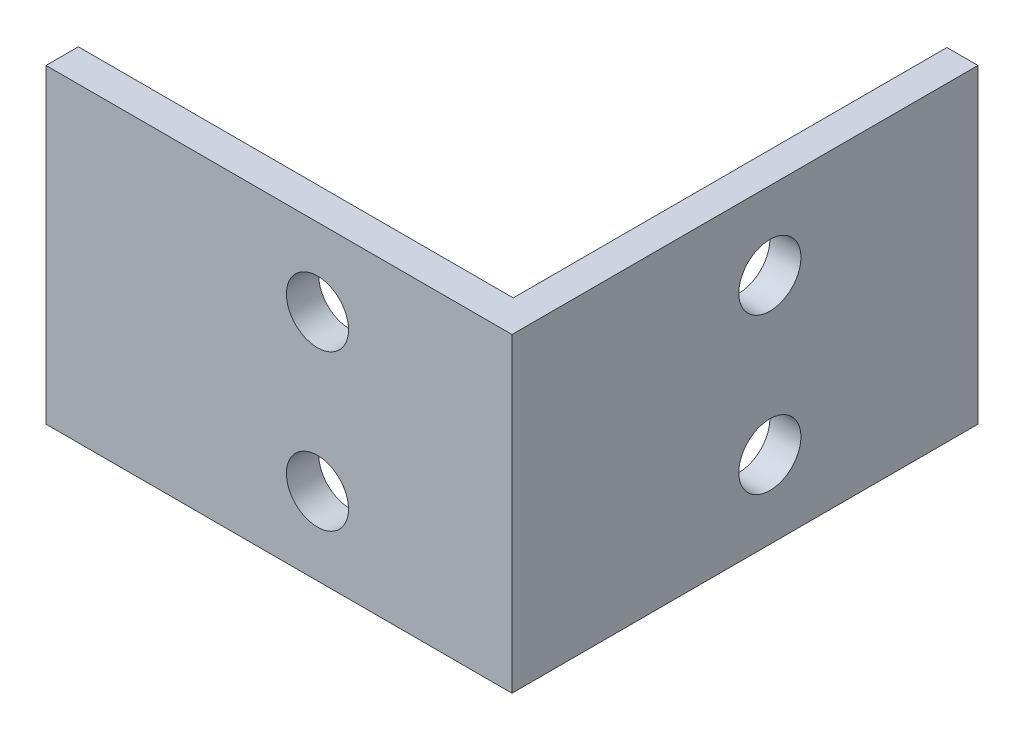
from build123d import *

# Parameters (mm, degrees)
BOSS_EXTRUDE1_DEPTH            = 20
CUT_EXTRUDE4_REACH             = 41.693
SKETCH2_R                      = 2
CUT_EXTRUDE4_DIRECTION_2_DEPTH = 40.693324376
CUT_EXTRUDE5_REACH             = 47.651
SKETCH3_R                      = 2


with BuildPart() as part:
    # Sketch1 → Boss-Extrude1 (new body)
    with BuildSketch(Plane(origin=(0, 0, 0), x_dir=(1, 0, 0), z_dir=(0, 1, 0))):
        Polygon((0, 13.4), (0, -14.52), (-28, -14.52), (-28, -16.6), (2, -16.6), (2, 13.4), align=None)
    extrude(amount=BOSS_EXTRUDE1_DEPTH)

    # Sketch2 → Cut-Extrude4 (cut, up to next)
    with BuildSketch(Plane(origin=(2, 0, 0), x_dir=(0, 0, -1), z_dir=(1, 0, 0)), mode=Mode.PRIVATE) as cut_extrude4_sk1:
        with Locations(Location((0, 15, 0), (0, 0, 180))):
            Circle(SKETCH2_R)
    cut_extrude4_tool1 = extrude(cut_extrude4_sk1.sketch, amount=-CUT_EXTRUDE4_REACH, mode=Mode.PRIVATE) & part.part
    # Sketch2 → Cut-Extrude4 (cut, up to next)
    with BuildSketch(Plane(origin=(2, 0, 0), x_dir=(0, 0, -1), z_dir=(1, 0, 0)), mode=Mode.PRIVATE) as cut_extrude4_sk2:
        with Locations(Location((0, 5, 0), (0, 0, 180))):
            Circle(SKETCH2_R)
    cut_extrude4_tool2 = extrude(cut_extrude4_sk2.sketch, amount=-CUT_EXTRUDE4_REACH, mode=Mode.PRIVATE) & part.part
    add(cut_extrude4_tool1.solids().sort_by_distance((2, 15, 0))[0], mode=Mode.SUBTRACT)
    add(cut_extrude4_tool2.solids().sort_by_distance((2, 5, 0))[0], mode=Mode.SUBTRACT)

    # Sketch2 → Cut-Extrude4 direction 2 (cut)
    with BuildSketch(Plane(origin=(2, 0, 0), x_dir=(0, 0, -1), z_dir=(1, 0, 0))):
        with Locations(Location((0, 15, 0), (0, 0, 180))):
            Circle(SKETCH2_R)
        with Locations(Location((0, 5, 0), (0, 0, 180))):
            Circle(SKETCH2_R)
    extrude(amount=CUT_EXTRUDE4_DIRECTION_2_DEPTH, mode=Mode.SUBTRACT)

    # Sketch3 → Cut-Extrude5 (cut, up to next)
    with BuildSketch(Plane.XY.offset(16.6), mode=Mode.PRIVATE) as cut_extrude5_sk1:
        with Locations((-10.523881442, 15)):
            Circle(SKETCH3_R)
    cut_extrude5_tool1 = extrude(cut_extrude5_sk1.sketch, amount=-CUT_EXTRUDE5_REACH, mode=Mode.PRIVATE) & part.part
    # Sketch3 → Cut-Extrude5 (cut, up to next)
    with BuildSketch(Plane.XY.offset(16.6), mode=Mode.PRIVATE) as cut_extrude5_sk2:
        with Locations((-10.523881442, 5)):
            Circle(SKETCH3_R)
    cut_extrude5_tool2 = extrude(cut_extrude5_sk2.sketch, amount=-CUT_EXTRUDE5_REACH, mode=Mode.PRIVATE) & part.part
    add(cut_extrude5_tool1.solids().sort_by_distance((-10.523881, 15, 16.6))[0], mode=Mode.SUBTRACT)
    add(cut_extrude5_tool2.solids().sort_by_distance((-10.523881, 5, 16.6))[0], mode=Mode.SUBTRACT)


solid = part.part
